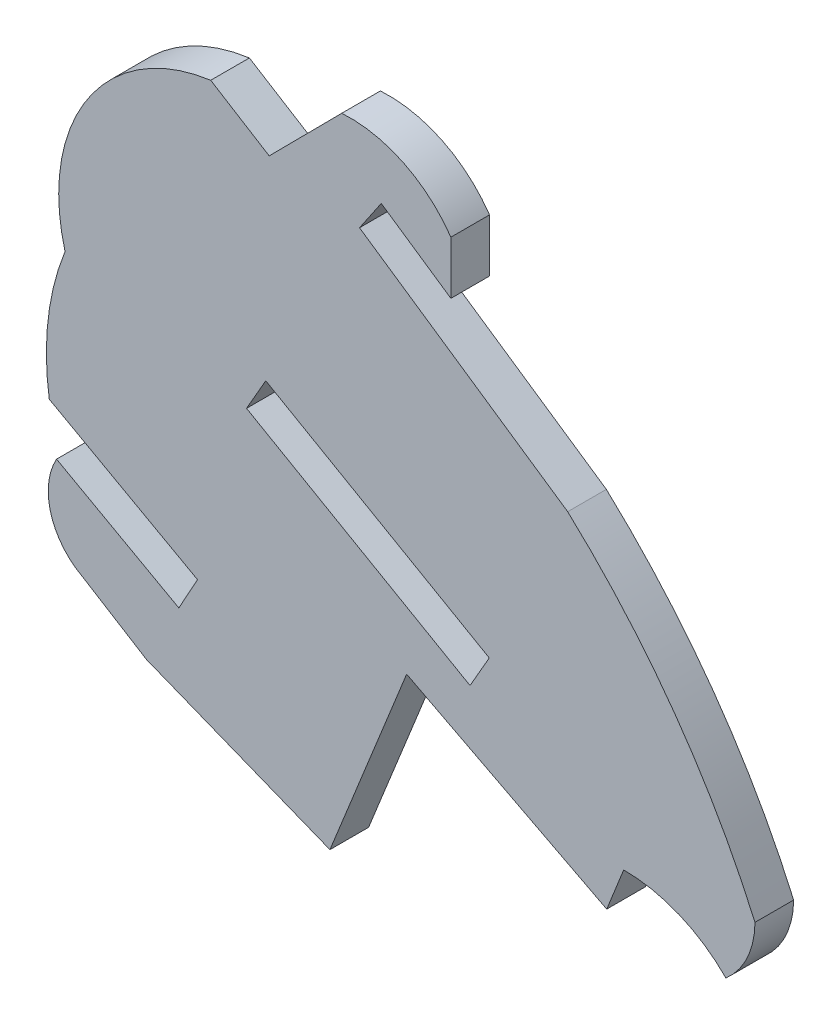
from build123d import *

# Parameters (mm, degrees)
BASE_EXTRUDE_DEPTH = 3


with BuildPart() as part:
    # Sketch1 → Base-Extrude (new body)
    with BuildSketch(Plane.XY):
        with BuildLine():
            Line((254.458999609, 72.42410604), (254.458999609, 68.312175266))
            Line((254.458999609, 68.312175266), (249.057113985, 71.99161005))
            Line((249.057113985, 71.99161005), (247.368253343, 69.512144436))
            Line((247.368253343, 69.512144436), (263.523901664, 58.507902857))
            ThreePointArc((263.523901664, 58.507902857), (271.838397848, 49.089575752), (278.059793662, 38.174908264))
            ThreePointArc((278.059793662, 38.174908264), (277.460971595, 35.494168544), (275.801504518, 33.305305293))
            ThreePointArc((275.801504518, 33.305305293), (272.168235705, 35.752461976), (267.87122217, 36.603868337))
            Line((267.87122217, 36.603868337), (266.553980851, 33.3090367))
            Line((266.553980851, 33.3090367), (251.02719612, 41.33883075))
            Line((251.02719612, 41.33883075), (245.072593427, 26.565797378))
            Line((245.072593427, 26.565797378), (230.827204858, 32.233531984))
            Line((230.827204858, 32.233531984), (225.897587097, 35.291364614))
            ThreePointArc((225.897587097, 35.291364614), (223.417826754, 38.317877983), (223.856638727, 42.205864427))
            Line((223.856638727, 42.205864427), (233.34569838, 36.950163447))
            Line((233.34569838, 36.950163447), (234.799244804, 39.574511517))
            Line((234.799244804, 39.574511517), (223.290021138, 45.949119784))
            ThreePointArc((223.290021138, 45.949119784), (223.201365162, 51.301598344), (224.516481401, 56.490755877))
            ThreePointArc((224.516481401, 56.490755877), (226.27528444, 67.636113231), (235.821369896, 73.651479483))
            Line((235.821369896, 73.651479483), (240.358475054, 70.837802847))
            Line((240.358475054, 70.837802847), (245.989993101, 76.519880328))
            ThreePointArc((245.989993101, 76.519880328), (250.765877804, 75.591430608), (254.458999609, 72.42410604))
        make_face()
        Polygon((240.093331419, 55.591825093), (257.438617194, 45.634864644), (255.945073126, 43.033071777), (238.599787351, 52.990032226), align=None, mode=Mode.SUBTRACT)
    extrude(amount=BASE_EXTRUDE_DEPTH)


solid = part.part
